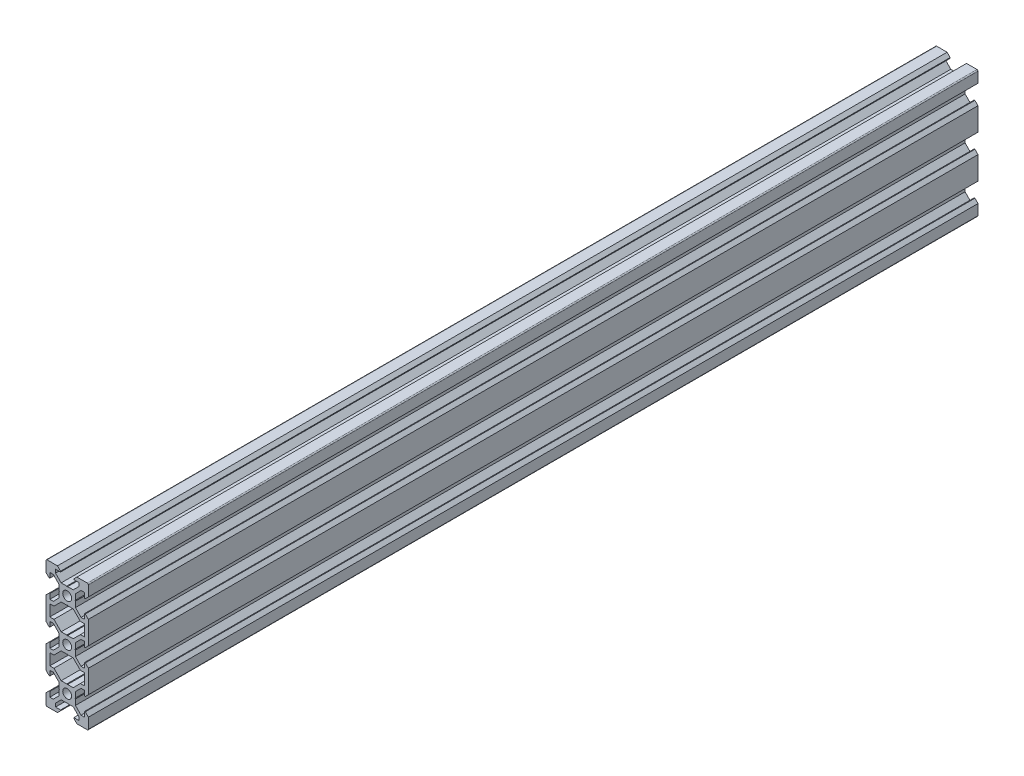
from build123d import *

# Parameters (mm, degrees)
BOSS_EXTRU_1_DEPTH = 420


with BuildPart() as part:
    # Esquisse1 → Boss.-Extru.1 (new body)
    with BuildSketch(Plane.XY):
        with BuildLine():
            Line((-9.5, 10), (-4.58, 10))
            Line((-4.58, 10), (-3.125, 8.545))
            Line((-3.125, 8.545), (-3.125, 8.2))
            Line((-3.125, 8.2), (-5.5, 8.2))
            Line((-5.5, 8.2), (-5.5, 6.560660172))
            Line((-5.5, 6.560660172), (-2.839339828, 3.9))
            Line((-2.839339828, 3.9), (-0.21, 3.9))
            Line((-0.21, 3.9), (0, 3.69))
            Line((0, 3.69), (0, 2.1))
            ThreePointArc((0, 2.1), (-2.1, 0), (0, -2.1))
            Line((0, -2.1), (0, -3.69))
            Line((0, -3.69), (-0.21, -3.9))
            Line((-0.21, -3.9), (-2.839339828, -3.9))
            Line((-2.839339828, -3.9), (-6.239339828, -7.3))
            Line((-6.239339828, -7.3), (-8.2, -7.3))
            Line((-8.2, -7.3), (-8.2, -12.7))
            Line((-8.2, -12.7), (-6.239339828, -12.7))
            Line((-6.239339828, -12.7), (-2.839339828, -16.1))
            Line((-2.839339828, -16.1), (-0.21, -16.1))
            Line((-0.21, -16.1), (0, -16.31))
            Line((0, -16.31), (0, -17.9))
            ThreePointArc((0, -17.9), (-2.1, -20), (0, -22.1))
            Line((0, -22.1), (0, -23.69))
            Line((0, -23.69), (-0.21, -23.9))
            Line((-0.21, -23.9), (-2.839339828, -23.9))
            Line((-2.839339828, -23.9), (-6.239339828, -27.3))
            Line((-6.239339828, -27.3), (-8.2, -27.3))
            Line((-8.2, -27.3), (-8.2, -32.7))
            Line((-8.2, -32.7), (-6.239339828, -32.7))
            Line((-6.239339828, -32.7), (-2.839339828, -36.1))
            Line((-2.839339828, -36.1), (-0.21, -36.1))
            Line((-0.21, -36.1), (0, -36.31))
            Line((0, -36.31), (0, -37.9))
            ThreePointArc((0, -37.9), (-2.1, -40), (0, -42.1))
            Line((0, -42.1), (0, -43.69))
            Line((0, -43.69), (-0.21, -43.9))
            Line((-0.21, -43.9), (-2.839339828, -43.9))
            Line((-2.839339828, -43.9), (-5.5, -46.560660172))
            Line((-5.5, -46.560660172), (-5.5, -48.2))
            Line((-5.5, -48.2), (-3.125, -48.2))
            Line((-3.125, -48.2), (-3.125, -48.545))
            Line((-3.125, -48.545), (-4.58, -50))
            Line((-4.58, -50), (-9.5, -50))
            ThreePointArc((-9.5, -50), (-9.853553391, -49.853553391), (-10, -49.5))
            Line((-10, -49.5), (-10, -44.58))
            Line((-10, -44.58), (-8.545, -43.125))
            Line((-8.545, -43.125), (-8.2, -43.125))
            Line((-8.2, -43.125), (-8.2, -45.5))
            Line((-8.2, -45.5), (-6.560660172, -45.5))
            Line((-6.560660172, -45.5), (-3.9, -42.839339828))
            Line((-3.9, -42.839339828), (-3.9, -40.21))
            Line((-3.9, -40.21), (-3.69, -40))
            Line((-3.69, -40), (-3.9, -39.79))
            Line((-3.9, -39.79), (-3.9, -37.160660172))
            Line((-3.9, -37.160660172), (-6.560660172, -34.5))
            Line((-6.560660172, -34.5), (-8.2, -34.5))
            Line((-8.2, -34.5), (-8.2, -36.875))
            Line((-8.2, -36.875), (-8.545, -36.875))
            Line((-8.545, -36.875), (-10, -35.42))
            Line((-10, -35.42), (-10, -24.58))
            Line((-10, -24.58), (-8.545, -23.125))
            Line((-8.545, -23.125), (-8.2, -23.125))
            Line((-8.2, -23.125), (-8.2, -25.5))
            Line((-8.2, -25.5), (-6.560660172, -25.5))
            Line((-6.560660172, -25.5), (-3.9, -22.839339828))
            Line((-3.9, -22.839339828), (-3.9, -20.21))
            Line((-3.9, -20.21), (-3.69, -20))
            Line((-3.69, -20), (-3.9, -19.79))
            Line((-3.9, -19.79), (-3.9, -17.160660172))
            Line((-3.9, -17.160660172), (-6.560660172, -14.5))
            Line((-6.560660172, -14.5), (-8.2, -14.5))
            Line((-8.2, -14.5), (-8.2, -16.875))
            Line((-8.2, -16.875), (-8.545, -16.875))
            Line((-8.545, -16.875), (-10, -15.42))
            Line((-10, -15.42), (-10, -4.58))
            Line((-10, -4.58), (-8.545, -3.125))
            Line((-8.545, -3.125), (-8.2, -3.125))
            Line((-8.2, -3.125), (-8.2, -5.5))
            Line((-8.2, -5.5), (-6.560660172, -5.5))
            Line((-6.560660172, -5.5), (-3.9, -2.839339828))
            Line((-3.9, -2.839339828), (-3.9, -0.21))
            Line((-3.9, -0.21), (-3.69, 0))
            Line((-3.69, 0), (-3.9, 0.21))
            Line((-3.9, 0.21), (-3.9, 2.839339828))
            Line((-3.9, 2.839339828), (-6.560660172, 5.5))
            Line((-6.560660172, 5.5), (-8.2, 5.5))
            Line((-8.2, 5.5), (-8.2, 3.125))
            Line((-8.2, 3.125), (-8.545, 3.125))
            Line((-8.545, 3.125), (-10, 4.58))
            Line((-10, 4.58), (-10, 9.5))
            ThreePointArc((-10, 9.5), (-9.853553391, 9.853553391), (-9.5, 10))
        make_face()
    boss_extru_1 = extrude(amount=BOSS_EXTRU_1_DEPTH)

    # Symétrie1: Boss.-Extru.1 across plane
    add(boss_extru_1.mirror(Plane(origin=(0, 3.69, 420), x_dir=(0, 0, 1), z_dir=(-1, 0, 0))))


solid = part.part
